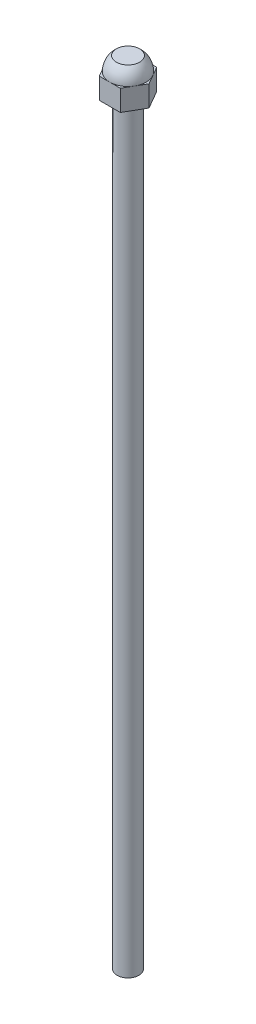
from build123d import *

# Parameters (mm, degrees)
SKETCH1_R           = 3.9
BOSS_EXTRUDE1_DEPTH = 270
BOSS_EXTRUDE2_DEPTH = 7.5


with BuildPart() as part:
    # Sketch1 → Boss-Extrude1 (new body)
    with BuildSketch(Plane(origin=(0, 0, 0), x_dir=(1, 0, 0), z_dir=(0, 1, 0))):
        with Locations(Location((0, 0, 0), (0, 0, 270))):
            Circle(SKETCH1_R)
    extrude(amount=BOSS_EXTRUDE1_DEPTH)

    # Sketch2 → Boss-Extrude2 (add)
    with BuildSketch(Plane(origin=(0, 270, 0), x_dir=(1, 0, 0), z_dir=(0, 1, 0))):
        Polygon((7.505553499, 0), (3.75277675, 6.5), (-3.75277675, 6.5), (-7.505553499, 0), (-3.75277675, -6.5), (3.75277675, -6.5), align=None)
    extrude(amount=BOSS_EXTRUDE2_DEPTH)

    # Sketch5 → Revolve2 (revolve)
    with BuildSketch(Plane(origin=(0, 0, 0), x_dir=(0.8660254037844384, 0, -0.5000000000000007), z_dir=(0.5000000000000006, 0, 0.8660254037844383))):
        with BuildLine():
            Line((0, 277.5), (6.5, 277.5))
            ThreePointArc((6.5, 277.5), (5.884153616, 280.261654617), (4.153311931, 282.5))
            Line((4.153311931, 282.5), (0, 282.5))
            Line((0, 282.5), (0, 277.5))
        make_face()
    revolve(axis=Axis((0, 282.5, 0), (0, -1, 0)))


solid = part.part
